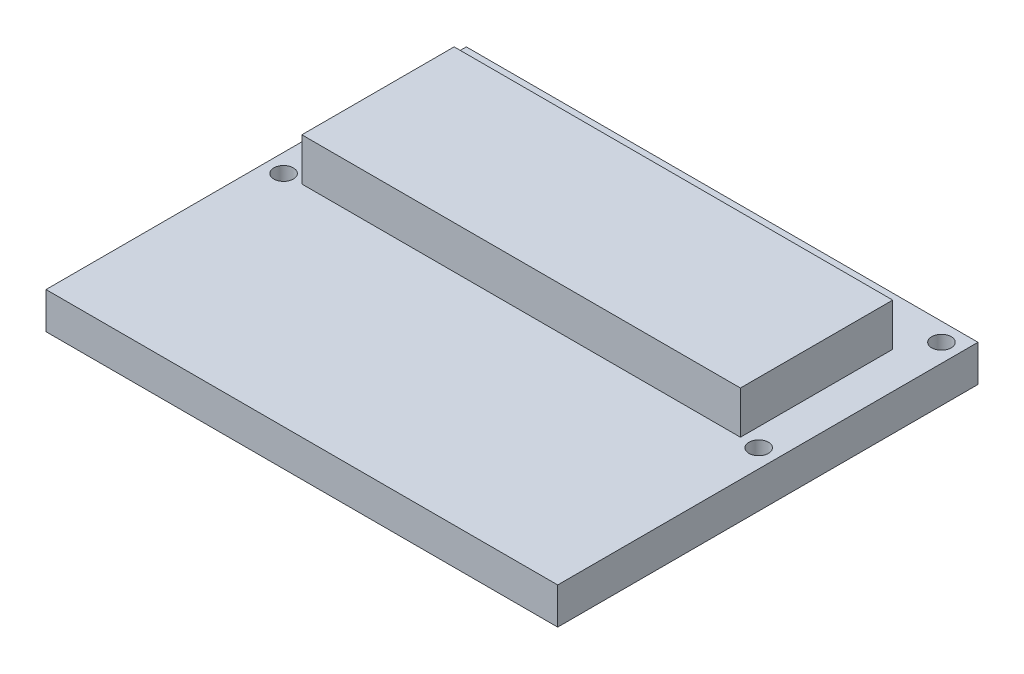
from build123d import *

# Parameters (mm, degrees)
SKETCH1_W           = 84
SKETCH1_H           = 69
BOSS_EXTRUDE1_DEPTH = 6
SKETCH2_W           = 72
SKETCH2_H           = 25
BOSS_EXTRUDE2_DEPTH = 7
SKETCH3_R           = 1.6
CUT_EXTRUDE1_DEPTH  = 55.801916025
SKETCH4_R           = 1.6
CUT_EXTRUDE2_DEPTH  = 55.801916025
SKETCH5_R           = 1.6
CUT_EXTRUDE3_DEPTH  = 55.801916025
SKETCH6_R           = 1.6
CUT_EXTRUDE4_DEPTH  = 55.801916025


with BuildPart() as part:
    # Sketch1 → Boss-Extrude1 (new body)
    with BuildSketch(Plane(origin=(0, 0, 0), x_dir=(1, 0, 0), z_dir=(0, 1, 0))):
        Rectangle(SKETCH1_W, SKETCH1_H)
    extrude(amount=BOSS_EXTRUDE1_DEPTH)

    # Sketch2 → Boss-Extrude2 (add)
    with BuildSketch(Plane(origin=(0, 6, 0), x_dir=(1, 0, 0), z_dir=(0, 1, 0))):
        with Locations((0, 14)):
            Rectangle(SKETCH2_W, SKETCH2_H)
    extrude(amount=BOSS_EXTRUDE2_DEPTH)

    # Sketch3 → Cut-Extrude1 (cut, through all)
    with BuildSketch(Plane(origin=(0, 6, 0), x_dir=(1, 0, 0), z_dir=(0, 1, 0))):
        with Locations(Location((-39, 31.5, 0), (0, 0, 270))):
            Circle(SKETCH3_R)
    extrude(amount=-CUT_EXTRUDE1_DEPTH, mode=Mode.SUBTRACT)

    # Sketch4 → Cut-Extrude2 (cut, through all)
    with BuildSketch(Plane(origin=(0, 6, 0), x_dir=(1, 0, 0), z_dir=(0, 1, 0))):
        with Locations(Location((39, 31.5, 0), (0, 0, 270))):
            Circle(SKETCH4_R)
    extrude(amount=-CUT_EXTRUDE2_DEPTH, mode=Mode.SUBTRACT)

    # Sketch5 → Cut-Extrude3 (cut, through all)
    with BuildSketch(Plane(origin=(0, 6, 0), x_dir=(1, 0, 0), z_dir=(0, 1, 0))):
        with Locations(Location((-39, 1.5, 0), (0, 0, 270))):
            Circle(SKETCH5_R)
    extrude(amount=-CUT_EXTRUDE3_DEPTH, mode=Mode.SUBTRACT)

    # Sketch6 → Cut-Extrude4 (cut, through all)
    with BuildSketch(Plane(origin=(0, 6, 0), x_dir=(1, 0, 0), z_dir=(0, 1, 0))):
        with Locations(Location((39, 1.5, 0), (0, 0, 270))):
            Circle(SKETCH6_R)
    extrude(amount=-CUT_EXTRUDE4_DEPTH, mode=Mode.SUBTRACT)


solid = part.part
